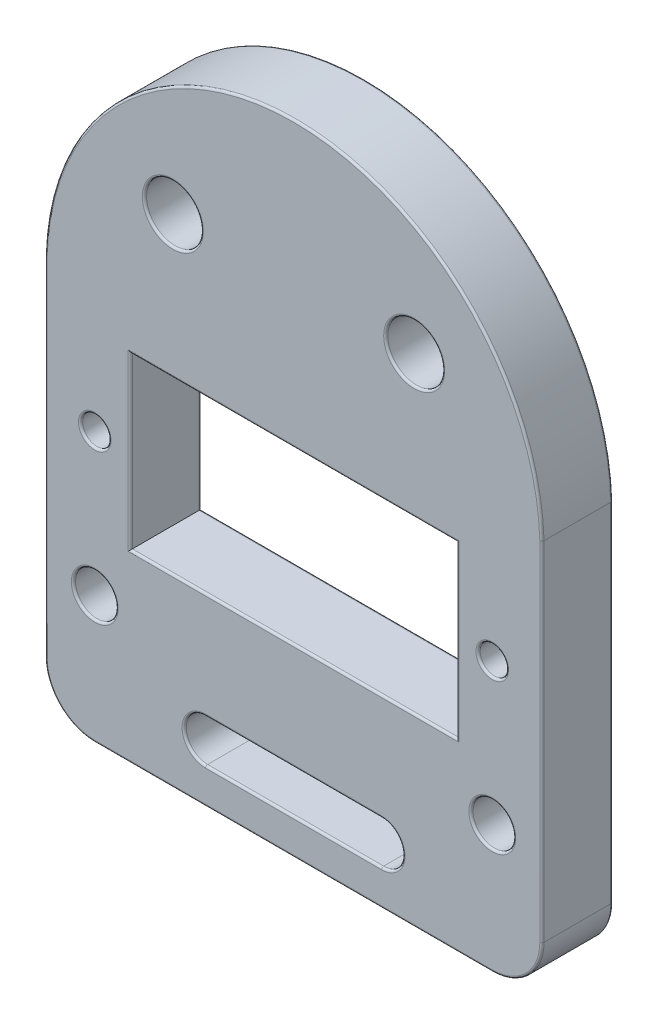
from build123d import *

# Parameters (mm, degrees)
SKETCH1_R           = 1
SKETCH1_R_2         = 1.5
SKETCH1_R_3         = 2
SKETCH1_W           = 23
SKETCH1_H           = 12
BOSS_EXTRUDE1_DEPTH = 5
FILLET1_R           = 3.5
FILLET2_R           = 0.15


with BuildPart() as part:
    # Sketch1 → Boss-Extrude1 (new body)
    with BuildSketch(Plane.XY):
        with BuildLine():
            Line((-17.5, 9), (-17.5, -19))
            Line((-17.5, -19), (17.5, -19))
            Line((17.5, -19), (17.5, 9))
            ThreePointArc((17.5, 9), (0, 26), (-17.5, 9))
        make_face()
        with Locations((-14, 0)):
            Circle(SKETCH1_R, mode=Mode.SUBTRACT)
        with Locations((-14, -10)):
            Circle(SKETCH1_R_2, mode=Mode.SUBTRACT)
        with Locations((-8.5, 16)):
            Circle(SKETCH1_R_3, mode=Mode.SUBTRACT)
        with Locations(Location((14, -10, 0), (0, 0, 180))):
            Circle(SKETCH1_R_2, mode=Mode.SUBTRACT)
        with Locations(Location((14, 0, 0), (0, 0, 180))):
            Circle(SKETCH1_R, mode=Mode.SUBTRACT)
        with Locations(Location((8.5, 16, 0), (0, 0, 180))):
            Circle(SKETCH1_R_3, mode=Mode.SUBTRACT)
        Rectangle(SKETCH1_W, SKETCH1_H, mode=Mode.SUBTRACT)
        with BuildLine():
            Line((6.2, -16.5), (-6.2, -16.5))
            ThreePointArc((-6.2, -16.5), (-7.7, -15), (-6.2, -13.5))
            Line((-6.2, -13.5), (6.2, -13.5))
            ThreePointArc((6.2, -13.5), (7.7, -15), (6.2, -16.5))
        make_face(mode=Mode.SUBTRACT)
    extrude(amount=BOSS_EXTRUDE1_DEPTH)

    # Fillet1
    fillet1_edges = [part.edges().sort_by_distance(p)[0] for p in [
        (17.5, -19, 2.5),
        (-17.5, -19, 2.5),
    ]]
    fillet(fillet1_edges, radius=FILLET1_R)

    # Fillet2
    fillet2_edges = [part.edges().sort_by_distance(p)[0] for p in [
        (-11.5, 0, 0),
        (0, -6, 0),
        (11.5, 0, 0),
        (0, 6, 0),
        (-11.5, 0, 5),
        (0, -6, 5),
        (11.5, 0, 5),
        (0, 6, 5),
        (-15, 0, 0),
        (-15, 0, 5),
        (-15.5, -10, 0),
        (-15.5, -10, 5),
        (7.7, -15, 0),
        (0, -13.5, 0),
        (-7.7, -15, 0),
        (0, -16.5, 0),
        (7.7, -15, 5),
        (0, -13.5, 5),
        (-7.7, -15, 5),
        (0, -16.5, 5),
        (0, 26, 5),
        (-10.5, 16, 0),
        (-10.5, 16, 5),
        (15.5, -10, 0),
        (15.5, -10, 5),
        (-17.5, -3.25, 0),
        (15, 0, 0),
        (15, 0, 5),
        (0, 26, 0),
        (10.5, 16, 0),
        (10.5, 16, 5),
        (0, -19, 0),
        (0, -19, 5),
        (17.5, -3.25, 0),
        (16.474873734, -17.974873734, 0),
        (-16.474873734, -17.974873734, 0),
        (-17.5, -3.25, 5),
        (17.5, -3.25, 5),
        (16.474873734, -17.974873734, 5),
        (-16.474873734, -17.974873734, 5),
    ]]
    fillet(fillet2_edges, radius=FILLET2_R)


solid = part.part
